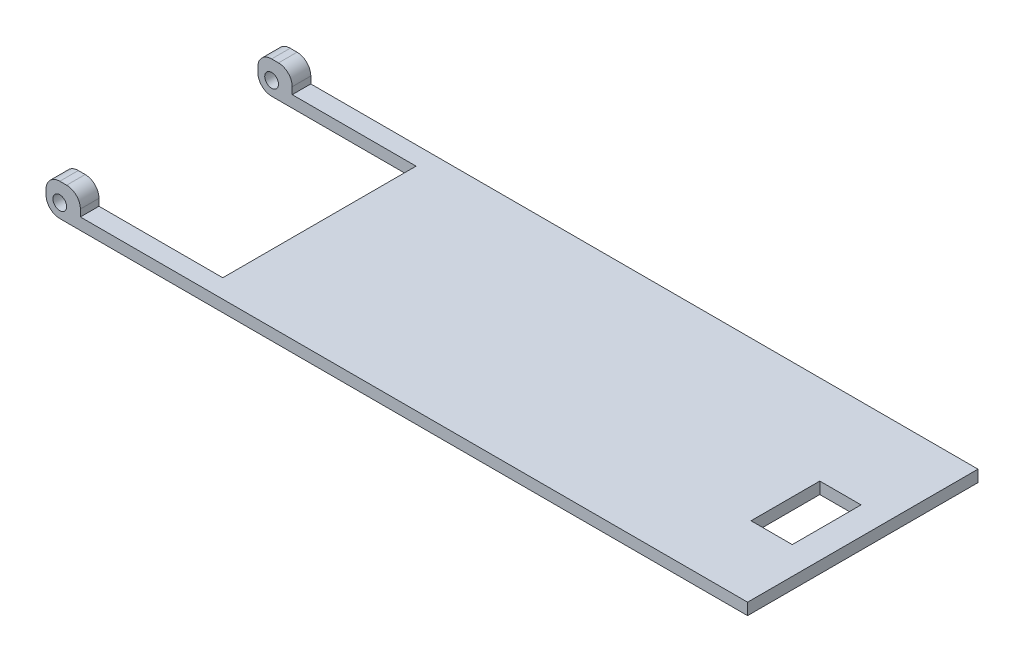
from build123d import *

# Parameters (mm, degrees)
SKETCH1_W            = 102
SKETCH1_H            = 33.5
BOSS_EXTRUDE1_DEPTH  = 1.7
SKETCH2_W            = 23
SKETCH2_H            = 28.1
CUT_EXTRUDE1_DEPTH   = 1.7
SKETCH4_W            = 5
SKETCH4_H            = 2.7
BOSS_EXTRUDE2_DEPTH  = 3
SKETCH5_R            = 1
CUT_EXTRUDE2_DEPTH   = 2.7
FILLET1_R            = 2
FILLET1_OF_MIRROR2_R = 2
SKETCH10_W           = 6
SKETCH10_H           = 10
CUT_EXTRUDE3_DEPTH   = 1.7


with BuildPart() as part:
    # Sketch1 → Boss-Extrude1 (new body)
    with BuildSketch(Plane(origin=(0, 0, 0), x_dir=(1, 0, 0), z_dir=(0, 1, 0))):
        Rectangle(SKETCH1_W, SKETCH1_H)
    extrude(amount=BOSS_EXTRUDE1_DEPTH)

    # Sketch2 → Cut-Extrude1 (cut)
    with BuildSketch(Plane(origin=(0, 1.7, 0), x_dir=(1, 0, 0), z_dir=(0, 1, 0))):
        with Locations((-39.5, 0)):
            Rectangle(SKETCH2_W, SKETCH2_H)
    extrude(amount=-CUT_EXTRUDE1_DEPTH, mode=Mode.SUBTRACT)

    # Sketch4 → Boss-Extrude2 (add)
    with BuildSketch(Plane(origin=(0, 1.7, 0), x_dir=(1, 0, 0), z_dir=(0, 1, 0))):
        with Locations((-48.5, -15.4)):
            Rectangle(SKETCH4_W, SKETCH4_H)
    boss_extrude2 = extrude(amount=BOSS_EXTRUDE2_DEPTH)

    # Sketch5 → Cut-Extrude2 (cut)
    with BuildSketch(Plane.XY.offset(16.75)):
        with Locations((-49, 2)):
            Circle(SKETCH5_R)
    cut_extrude2 = extrude(amount=-CUT_EXTRUDE2_DEPTH, mode=Mode.SUBTRACT)

    # Fillet1
    fillet1_edges = [part.edges().sort_by_distance(p)[0] for p in [
        (-51, 0, 15.4),
        (-51, 4.7, 15.4),
        (-46, 4.7, 15.4),
    ]]
    fillet(fillet1_edges, radius=FILLET1_R)

    # Mirror2: Boss-Extrude2, Cut-Extrude2 across plane
    add(boss_extrude2.mirror(Plane.XY))
    add(cut_extrude2.mirror(Plane.XY), mode=Mode.SUBTRACT)

    # Fillet1 of Mirror2
    fillet1_of_mirror2_edges = [part.edges().sort_by_distance(p)[0] for p in [
        (-51, 0, -15.4),
        (-51, 4.7, -15.4),
        (-46, 4.7, -15.4),
    ]]
    fillet(fillet1_of_mirror2_edges, radius=FILLET1_OF_MIRROR2_R)

    # Sketch10 → Cut-Extrude3 (cut)
    with BuildSketch(Plane(origin=(0, 1.7, 0), x_dir=(1, 0, 0), z_dir=(0, 1, 0))):
        with Locations((44, -1.25)):
            Rectangle(SKETCH10_W, SKETCH10_H)
    extrude(amount=-CUT_EXTRUDE3_DEPTH, mode=Mode.SUBTRACT)


solid = part.part
